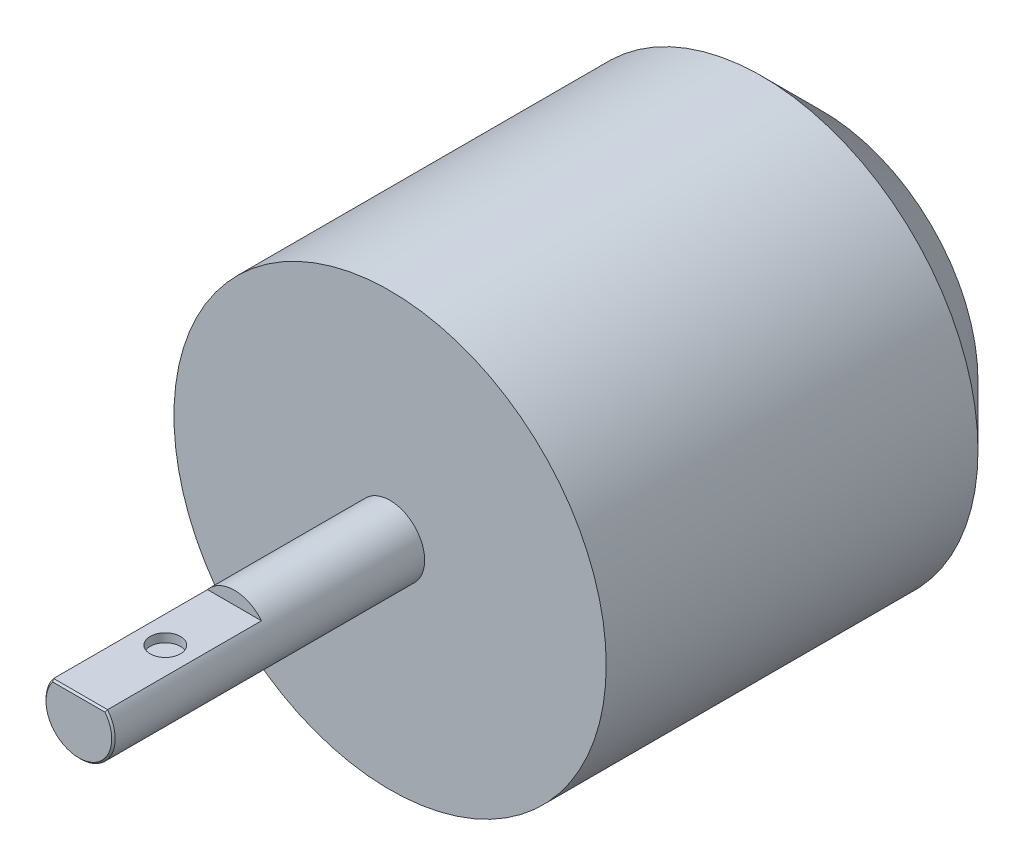
from build123d import *

# Parameters (mm, degrees)
SKETCH_1_R          = 25
EXTRUDE_1_DEPTH     = 50
CHAMFER_1_SIZE      = 7
SKETCH_2_R          = 10
EXTRUDE_2_DEPTH     = 1.5
SKETCH_3_R          = 4
EXTRUDE_3_DEPTH     = 36
CUT_EXTRUDE_1_DEPTH = 18
SKETCH_5_R          = 1.75
CUT_EXTRUDE_2_DEPTH = 1
CHAMFER_2_SIZE      = 0.2


with BuildPart() as part:
    # 草图1 → 凸台-拉伸1 (new body)
    with BuildSketch(Plane.XY):
        Circle(SKETCH_1_R)
    extrude(amount=EXTRUDE_1_DEPTH)

    # 倒角1
    chamfer_1_edges = [part.edges().sort_by_distance(p)[0] for p in [
        (-25, 0, 0),
    ]]
    chamfer(chamfer_1_edges, length=CHAMFER_1_SIZE)

    # 草图2 → 凸台-拉伸2 (add)
    with BuildSketch(Plane(origin=(0, 0, 0), x_dir=(-1, 0, 0), z_dir=(0, 0, -1))):
        Circle(SKETCH_2_R)
    extrude(amount=EXTRUDE_2_DEPTH)

    # 草图3 → 凸台-拉伸3 (add)
    with BuildSketch(Plane.XY.offset(50)):
        Circle(SKETCH_3_R)
    extrude(amount=EXTRUDE_3_DEPTH)

    # 草图4 → 切除-拉伸1 (cut)
    with BuildSketch(Plane.XY.offset(86)):
        Polygon((-91.7895175, 2.5), (-3.122498999, 2.5), (3.122498999, 2.5), (91.7895175, 2.5), (91.7895175, 179.834037002), (-91.7895175, 179.834037002), align=None)
    extrude(amount=-CUT_EXTRUDE_1_DEPTH, mode=Mode.SUBTRACT)

    # 草图5 → 切除-拉伸2 (cut)
    with BuildSketch(Plane(origin=(0, 2.5, 0), x_dir=(1, 0, 0), z_dir=(0, 1, 0))):
        with Locations(Location((0, -76, 0), (0, 0, 270))):
            Circle(SKETCH_5_R)
    extrude(amount=-CUT_EXTRUDE_2_DEPTH, mode=Mode.SUBTRACT)

    # 倒角2
    chamfer_2_edges = [part.edges().sort_by_distance(p)[0] for p in [
        (-1.324764885, -3.774254628, 86),
        (0, 2.5, 86),
    ]]
    chamfer(chamfer_2_edges, length=CHAMFER_2_SIZE)


solid = part.part
